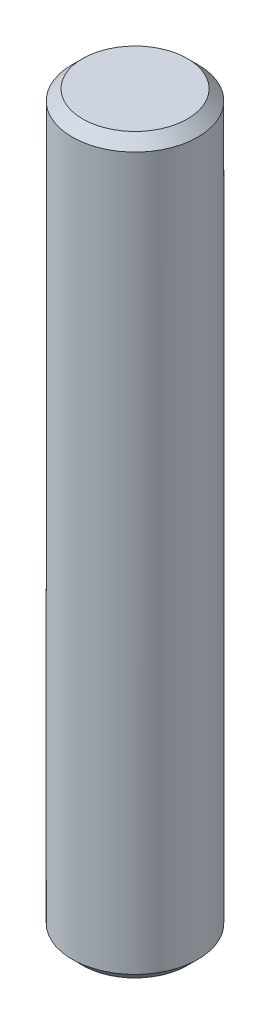
from build123d import *

# Parameters (mm, degrees)
SKETCH1_W     = 6
SKETCH1_H     = 70
CHAMFER1_SIZE = 1


with BuildPart() as part:
    # Sketch1 → Revolve1 (revolve)
    with BuildSketch(Plane.XY, mode=Mode.PRIVATE) as revolve1_sk:
        with Locations((3, 35)):
            Rectangle(SKETCH1_W, SKETCH1_H)
    revolve(revolve1_sk.sketch.rotate(Axis((0, 0, 0), (0, 1, 0)), 90), axis=Axis((0, 0, 0), (0, 1, 0)))

    # Chamfer1
    chamfer1_edges = [part.edges().sort_by_distance(p)[0] for p in [
        (0, 0, 6),
        (0, 70, 6),
    ]]
    chamfer(chamfer1_edges, length=CHAMFER1_SIZE)


solid = part.part
